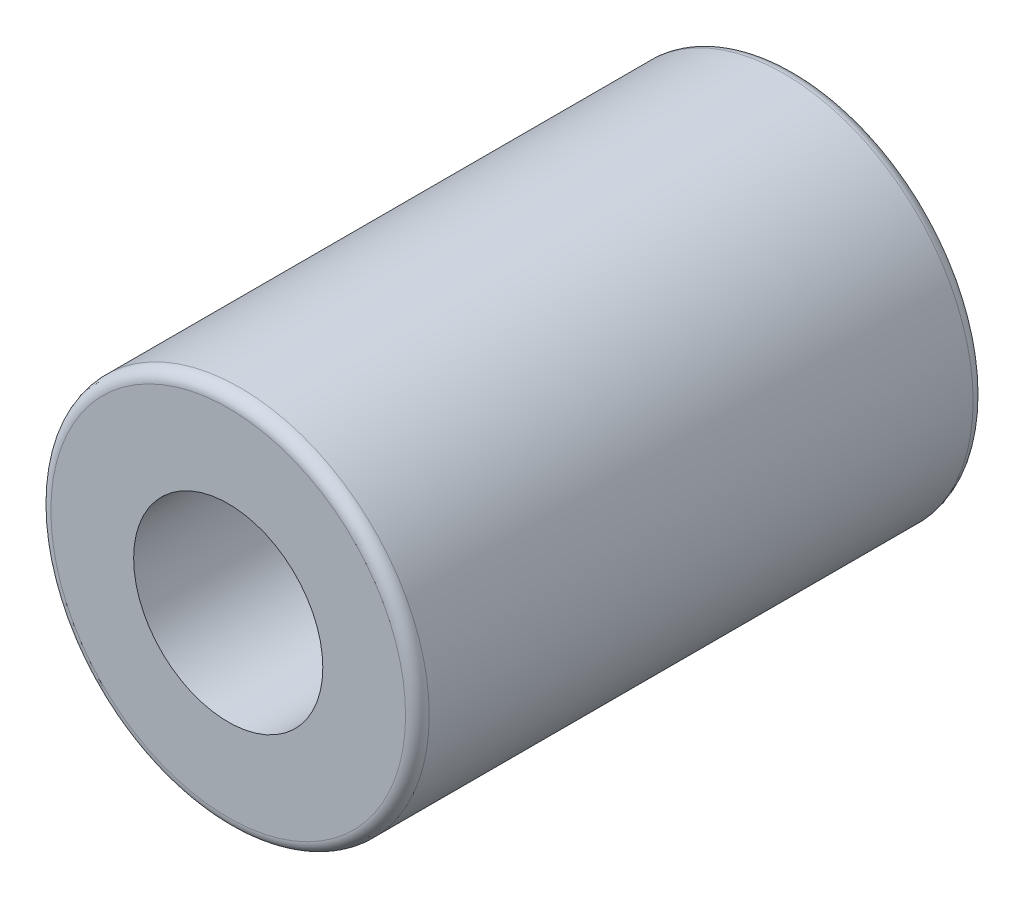
from build123d import *

# Parameters (mm, degrees)
SKETCH1_R           = 4
SKETCH1_R_2         = 2
BOSS_EXTRUDE1_DEPTH = 12
FILLET1_R           = 0.25


with BuildPart() as part:
    # Sketch1 → Boss-Extrude1 (new body)
    with BuildSketch(Plane.XY):
        Circle(SKETCH1_R)
        Circle(SKETCH1_R_2, mode=Mode.SUBTRACT)
    extrude(amount=BOSS_EXTRUDE1_DEPTH)

    # Fillet1
    fillet1_edges = [part.edges().sort_by_distance(p)[0] for p in [
        (-4, 0, 0),
        (-4, 0, 12),
    ]]
    fillet(fillet1_edges, radius=FILLET1_R)


solid = part.part
